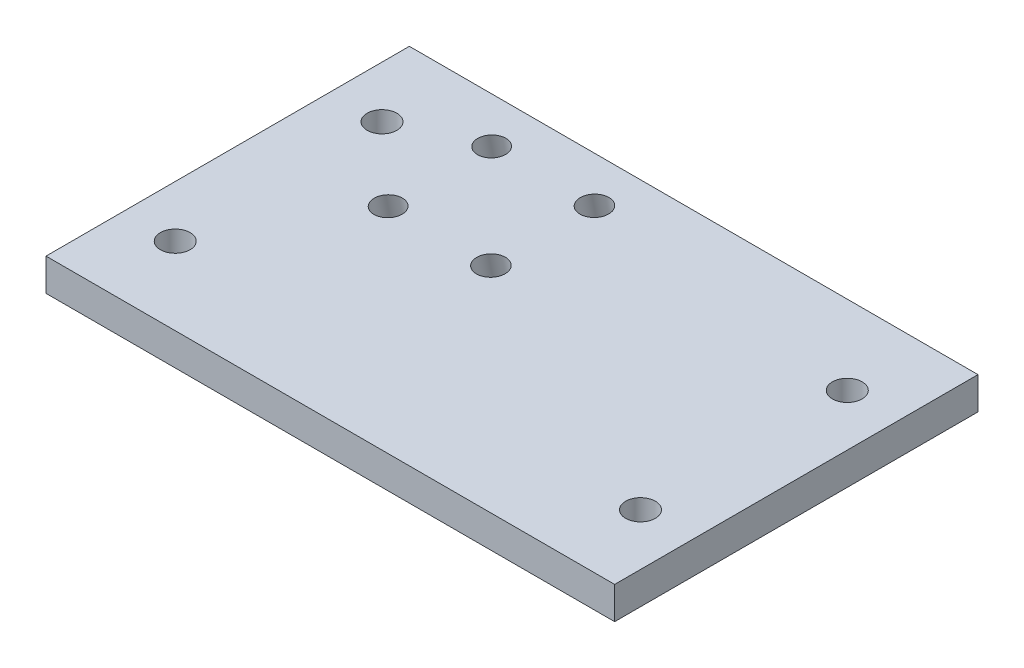
from build123d import *

# Parameters (mm, degrees)
SKETCH1_W           = 90
SKETCH1_H           = 56.23
BOSS_EXTRUDE1_DEPTH = 5
SKETCH2_R           = 2.3
CUT_EXTRUDE1_DEPTH  = 15
SKETCH7_R           = 2.3
CUT_EXTRUDE3_DEPTH  = 45
SKETCH9_W           = 61.183864123
SKETCH9_H           = 5.04390519
CUT_EXTRUDE4_DEPTH  = 2
SKETCH11_R          = 2.159579804
SKETCH11_R_2        = 2.2
SKETCH11_R_3        = 2.200145532
CUT_EXTRUDE5_DEPTH  = 20


with BuildPart() as part:
    # Sketch1 → Boss-Extrude1 (new body)
    with BuildSketch(Plane(origin=(0, 0, 0), x_dir=(1, 0, 0), z_dir=(0, 1, 0))):
        with Locations((45, 28.115)):
            Rectangle(SKETCH1_W, SKETCH1_H)
    extrude(amount=BOSS_EXTRUDE1_DEPTH)

    # Sketch2 → Cut-Extrude1 (cut)
    with BuildSketch(Plane(origin=(0, 5, 0), x_dir=(1, 0, 0), z_dir=(0, 1, 0))):
        with Locations(Location((82, 12, 0), (0, 0, 270))):
            Circle(SKETCH2_R)
        with Locations(Location((10, 12, 0), (0, 0, 270))):
            Circle(SKETCH2_R)
    extrude(amount=-CUT_EXTRUDE1_DEPTH, mode=Mode.SUBTRACT)

    # Sketch7 → Cut-Extrude3 (cut)
    with BuildSketch(Plane(origin=(0, 5, 0), x_dir=(1, 0, 0), z_dir=(0, 1, 0))):
        with Locations(Location((82, 44, 0), (0, 0, 270))):
            Circle(SKETCH7_R)
        with Locations(Location((10, 44, 0), (0, 0, 270))):
            Circle(SKETCH7_R)
    extrude(amount=-CUT_EXTRUDE3_DEPTH, mode=Mode.SUBTRACT)

    # Sketch9 → Cut-Extrude4 (cut)
    with BuildSketch(Plane.ZY):
        with Locations((-25.638067939, 2.521952595)):
            Rectangle(SKETCH9_W, SKETCH9_H)
    extrude(amount=-CUT_EXTRUDE4_DEPTH, mode=Mode.SUBTRACT)

    # Sketch11 → Cut-Extrude5 (cut)
    with BuildSketch(Plane(origin=(0, 4.817959636, 0.936516484), x_dir=(1, 0, 0), z_dir=(0, 0.9816271834476639, 0.19080899537654525))):
        with Locations(Location((21.790317182, 49.227295285, 0), (0, 0, 270))):
            Circle(SKETCH11_R)
        with Locations(Location((37.700491288, 49.227295285, 0), (0, 0, 270))):
            Circle(SKETCH11_R_2)
        with Locations(Location((37.700491288, 33.498951741, 0), (0, 0, 270))):
            Circle(SKETCH11_R_3)
        with Locations(Location((21.790317182, 33.498951741, 0), (0, 0, 270))):
            Circle(SKETCH11_R)
    extrude(amount=-CUT_EXTRUDE5_DEPTH, mode=Mode.SUBTRACT)


solid = part.part
